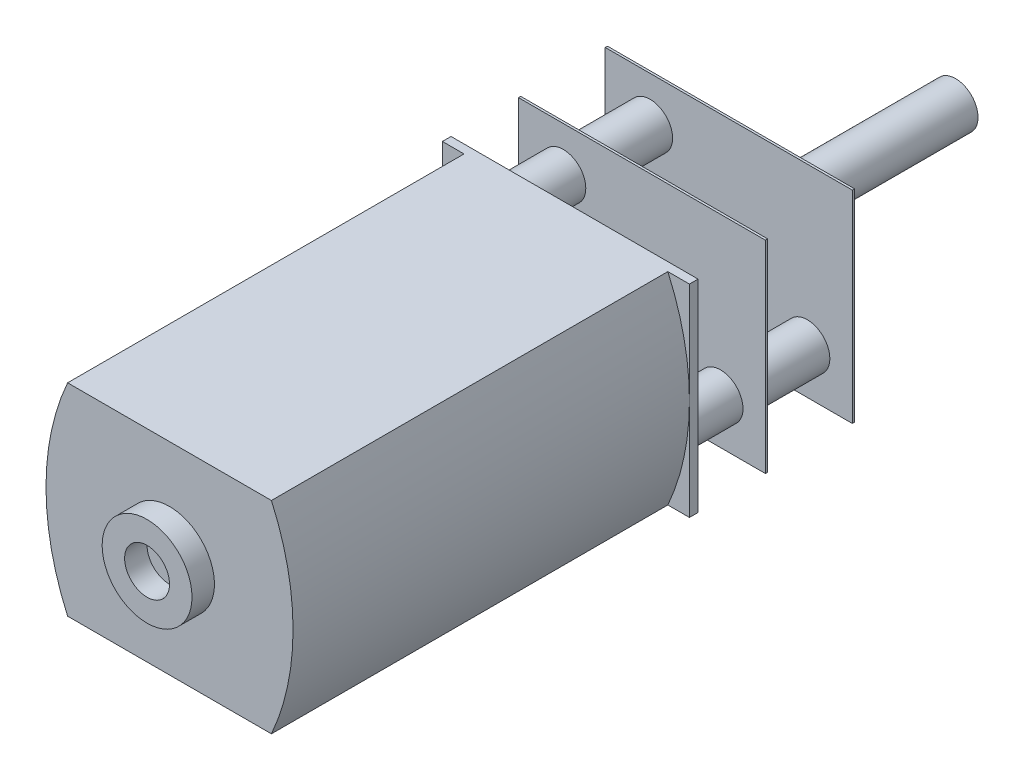
from build123d import *

# Parameters (mm, degrees)
SKETCH1_W           = 11
SKETCH1_H           = 25
BOSS_EXTRUDE1_DEPTH = 9
SKETCH2_W           = 11
SKETCH2_H           = 3
SKETCH2_H_2         = 3.765669969
CUT_EXTRUDE2_DEPTH  = 29.757607689
CUT_EXTRUDE3_DEPTH  = 17.65
BOSS_EXTRUDE2_START = -6.96567
SKETCH4_R           = 1
BOSS_EXTRUDE2_DEPTH = 6.86567
SKETCH5_R           = 2
SKETCH5_R_2         = 1
BOSS_EXTRUDE3_DEPTH = 1
SKETCH6_R           = 1
BOSS_EXTRUDE4_DEPTH = 10


with BuildPart() as part:
    # Sketch1 → Boss-Extrude1 (new body)
    with BuildSketch(Plane(origin=(0, 0, 0), x_dir=(1, 0, 0), z_dir=(0, 1, 0))):
        with Locations((5.5, 12.5)):
            Rectangle(SKETCH1_W, SKETCH1_H)
    extrude(amount=BOSS_EXTRUDE1_DEPTH)

    # Sketch2 → Cut-Extrude2 (cut, through all)
    with BuildSketch(Plane(origin=(0, 9, 0), x_dir=(1, 0, 0), z_dir=(0, 1, 0))):
        with Locations((5.5, 19.534330031)):
            Rectangle(SKETCH2_W, SKETCH2_H)
        with Locations((5.5, 23.017165016)):
            Rectangle(SKETCH2_W, SKETCH2_H_2)
    extrude(amount=-CUT_EXTRUDE2_DEPTH, mode=Mode.SUBTRACT)


with BuildPart() as cut_extrude2_piece_1:
    # of the separate pieces the step leaves, piece 1, a body of its own (cut_extrude2_pieces)
    add(part.part.solids().sort_by_distance((0, 0, 0))[0])

    # Sketch3 → Cut-Extrude3 (cut)
    with BuildSketch(Plane.XY):
        with BuildLine():
            Line((11, 9), (10.03742995, 9))
            ThreePointArc((10.03742995, 9), (10.756666057, 6.800898811), (11, 4.500000028))
            Line((11, 4.500000028), (11, 9))
        make_face()
        with BuildLine():
            Line((11, 0), (11, 4.500000028))
            ThreePointArc((11, 4.500000028), (10.756666063, 2.199101216), (10.03742995, 0))
            Line((10.03742995, 0), (11, 0))
        make_face()
        with BuildLine():
            ThreePointArc((0.96257005, 0), (0.243333935, 2.199101225), (0, 4.500000045))
            Line((0, 4.500000045), (0, 0))
            Line((0, 0), (0.96257005, 0))
        make_face()
        with BuildLine():
            ThreePointArc((0, 4.500000045), (0.243333945, 6.800898819), (0.96257005, 9))
            Line((0.96257005, 9), (0, 9))
            Line((0, 9), (0, 4.500000045))
        make_face()
    extrude(amount=-CUT_EXTRUDE3_DEPTH, mode=Mode.SUBTRACT)



with BuildPart() as cut_extrude2_piece_2:
    # of the separate pieces the step leaves, piece 2, a body of its own (cut_extrude2_pieces)
    add(part.part.solids().sort_by_distance((0, 0, -21.134330031))[0])


with BuildPart() as cut_extrude2_piece_3:
    # of the separate pieces the step leaves, piece 3, a body of its own (cut_extrude2_pieces)
    add(part.part.solids().sort_by_distance((0, 0, -25))[0])


with BuildPart() as cut_extrude2_piece_1_1:
    add(cut_extrude2_piece_1.part)

    add(cut_extrude2_piece_2.part)  # Boss-Extrude2 merges Cut-Extrude2 piece 2

    add(cut_extrude2_piece_3.part)  # Boss-Extrude2 merges Cut-Extrude2 piece 3
    # Sketch4 → Boss-Extrude2 (add)
    with BuildSketch(Plane(origin=(0, 0, -25), x_dir=(-1, 0, 0), z_dir=(0, 0, -1)).offset(BOSS_EXTRUDE2_START)):
        with Locations((-2, 7)):
            Circle(SKETCH4_R)
        with Locations(Location((-9, 2, 0), (0, 0, 180))):
            Circle(SKETCH4_R)
    extrude(amount=BOSS_EXTRUDE2_DEPTH)

    # Sketch5 → Boss-Extrude3 (add)
    with BuildSketch(Plane.XY):
        with Locations(Location((5.5, 4.5, 0), (0, 0, 180))):
            Circle(SKETCH5_R)
        with Locations((5.5, 4.5)):
            Circle(SKETCH5_R_2, mode=Mode.SUBTRACT)
    extrude(amount=BOSS_EXTRUDE3_DEPTH)

    # Sketch6 → Boss-Extrude4 (add)
    with BuildSketch(Plane(origin=(0, 0, -25), x_dir=(-1, 0, 0), z_dir=(0, 0, -1))):
        with Locations(Location((-5.5, 4.5, 0), (0, 0, 180))):
            Circle(SKETCH6_R)
    extrude(amount=BOSS_EXTRUDE4_DEPTH)


solid = cut_extrude2_piece_1_1.part
